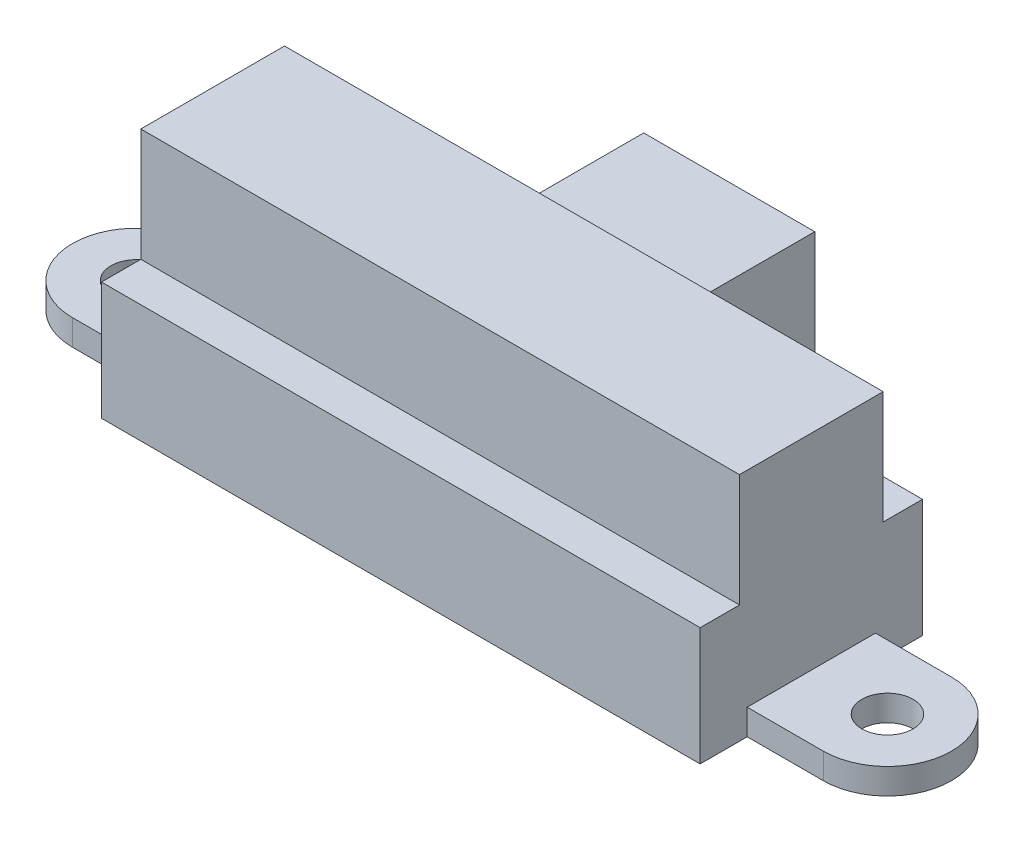
from build123d import *

# Parameters (mm, degrees)
SKETCH1_W           = 35
SKETCH1_H           = 13
BOSS_EXTRUDE1_DEPTH = 13.5
BOSS_EXTRUDE2_DEPTH = 1.5
BOSS_EXTRUDE3_DEPTH = 1.5
SKETCH4_R           = 1.5
CUT_EXTRUDE1_DEPTH  = 1.5
SKETCH5_W           = 35
SKETCH5_H           = 2.3
CUT_EXTRUDE2_DEPTH  = 6.6
SKETCH6_W           = 10
SKETCH6_H           = 6.2
BOSS_EXTRUDE4_DEPTH = 6.2
SKETCH6_2_W         = 10
SKETCH6_2_H         = 6.2
BOSS_EXTRUDE5_DEPTH = 2.3


with BuildPart() as part:
    # Sketch1 → Boss-Extrude1 (new body)
    with BuildSketch(Plane(origin=(0, 0, 0), x_dir=(1, 0, 0), z_dir=(0, 1, 0))):
        Rectangle(SKETCH1_W, SKETCH1_H)
    extrude(amount=BOSS_EXTRUDE1_DEPTH)

    # Sketch2 → Boss-Extrude2 (add)
    with BuildSketch(Plane.XZ):
        with BuildLine():
            Line((17.5, 3.75), (17.5, -3.75))
            Line((17.5, -3.75), (21.95, -3.75))
            ThreePointArc((21.95, -3.75), (25.7, 0), (21.95, 3.75))
            Line((21.95, 3.75), (17.5, 3.75))
        make_face()
    extrude(amount=-BOSS_EXTRUDE2_DEPTH)

    # Sketch3 → Boss-Extrude3 (add)
    with BuildSketch(Plane.XZ):
        with BuildLine():
            Line((-17.5, 3.75), (-17.5, -3.75))
            Line((-17.5, -3.75), (-21.95, -3.75))
            ThreePointArc((-21.95, -3.75), (-25.7, 0), (-21.95, 3.75))
            Line((-21.95, 3.75), (-17.5, 3.75))
        make_face()
    extrude(amount=-BOSS_EXTRUDE3_DEPTH)

    # Sketch4 → Cut-Extrude1 (cut)
    with BuildSketch(Plane(origin=(0, 1.5, 0), x_dir=(1, 0, 0), z_dir=(0, 1, 0))):
        with Locations(Location((21.95, 0, 0), (0, 0, 270))):
            Circle(SKETCH4_R)
    cut_extrude1 = extrude(amount=-CUT_EXTRUDE1_DEPTH, mode=Mode.SUBTRACT)

    # Mirror1: Cut-Extrude1 across plane
    add(cut_extrude1.mirror(Plane(origin=(0, 0, 0), x_dir=(0, 0, 1), z_dir=(1, 0, 0))), mode=Mode.SUBTRACT)

    # Sketch5 → Cut-Extrude2 (cut)
    with BuildSketch(Plane(origin=(0, 13.5, 0), x_dir=(1, 0, 0), z_dir=(0, 1, 0))):
        with Locations((0, 5.35)):
            Rectangle(SKETCH5_W, SKETCH5_H)
        with Locations((0, -5.35)):
            Rectangle(SKETCH5_W, SKETCH5_H)
    extrude(amount=-CUT_EXTRUDE2_DEPTH, mode=Mode.SUBTRACT)

    # Sketch6 → Boss-Extrude4 (add)
    with BuildSketch(Plane(origin=(0, 0, -6.5), x_dir=(-1, 0, 0), z_dir=(0, 0, -1))):
        with Locations((0, 8)):
            Rectangle(SKETCH6_W, SKETCH6_H)
    extrude(amount=BOSS_EXTRUDE4_DEPTH)

    # Sketch6<2> → Boss-Extrude5 (add)
    with BuildSketch(Plane(origin=(0, 0, -6.5), x_dir=(-1, 0, 0), z_dir=(0, 0, -1))):
        with Locations((0, 8)):
            Rectangle(SKETCH6_2_W, SKETCH6_2_H)
    extrude(amount=-BOSS_EXTRUDE5_DEPTH)


solid = part.part
